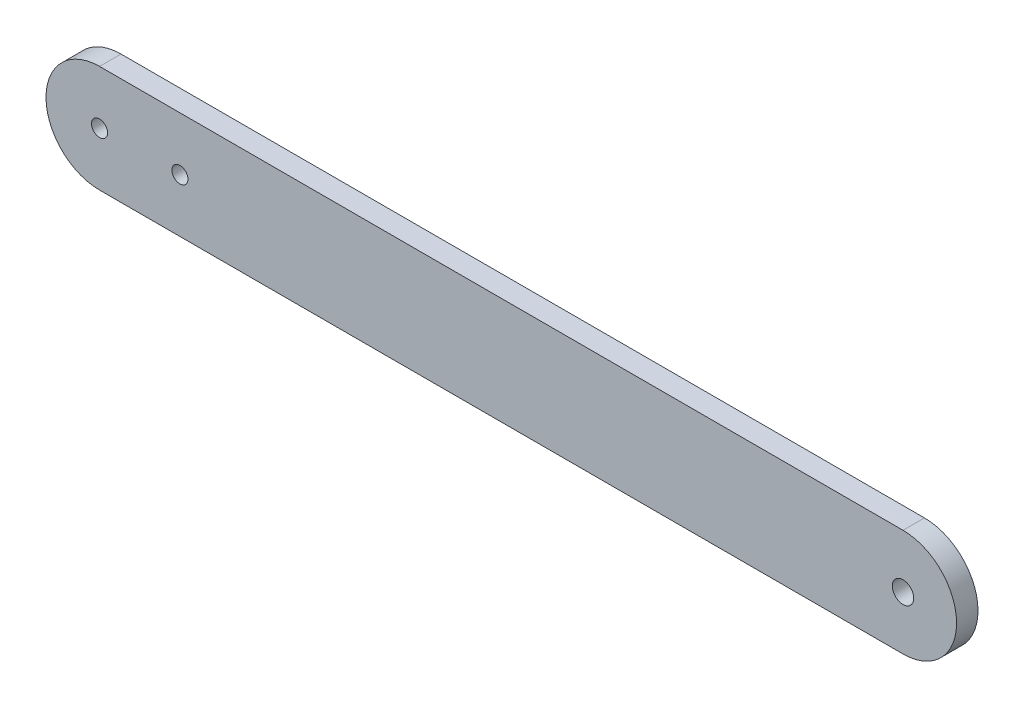
from build123d import *

# Parameters (mm, degrees)
ESQUISSE1_W        = 170
ESQUISSE1_H        = 20
ESQUISSE1_R        = 1.5
ESQUISSE1_R_2      = 2
BOSS_EXTRU_1_DEPTH = 4
CONG_1_RADIUS      = 10
CONG_1_LENGTH      = 4
CONG_2_RADIUS      = 10
CONG_2_LENGTH      = 4


with BuildPart() as part:
    # Esquisse1 → Boss.-Extru.1 (new body)
    with BuildSketch(Plane.XY):
        with Locations((-85, 10)):
            Rectangle(ESQUISSE1_W, ESQUISSE1_H)
        with Locations((-160, 10)):
            Circle(ESQUISSE1_R, mode=Mode.SUBTRACT)
        with Locations((-10, 10)):
            Circle(ESQUISSE1_R_2, mode=Mode.SUBTRACT)
        with Locations((-145, 10)):
            Circle(ESQUISSE1_R, mode=Mode.SUBTRACT)
    extrude(amount=BOSS_EXTRU_1_DEPTH)

    # Congé1: full round fillet: the end face becomes a half cylinder, R = half its width
    cong_1_face = Plane((-170, 10, 2), x_dir=(0, 0, 1), z_dir=(-1, 0, 0))  # on the end face: x along it, z out of the body
    cong_1_slab = cong_1_face.offset(-CONG_1_RADIUS / 2) * Box(CONG_1_LENGTH, 2 * CONG_1_RADIUS, CONG_1_RADIUS, mode=Mode.PRIVATE)  # the body's end, R deep
    cong_1_round = Plane((-160, 10, 2), x_dir=(-1, 0, 0), z_dir=(0, 0, 1)) * Cylinder(CONG_1_RADIUS, CONG_1_LENGTH, mode=Mode.PRIVATE)  # its axis R under the face
    add(cong_1_slab - cong_1_round, mode=Mode.SUBTRACT)

    # Congé2: full round fillet: the end face becomes a half cylinder, R = half its width
    cong_2_face = Plane((0, 10, 2), x_dir=(0, 0, -1), z_dir=(1, 0, 0))  # on the end face: x along it, z out of the body
    cong_2_slab = cong_2_face.offset(-CONG_2_RADIUS / 2) * Box(CONG_2_LENGTH, 2 * CONG_2_RADIUS, CONG_2_RADIUS, mode=Mode.PRIVATE)  # the body's end, R deep
    cong_2_round = Plane((-10, 10, 2), x_dir=(1, 0, 0), z_dir=(0, 0, -1)) * Cylinder(CONG_2_RADIUS, CONG_2_LENGTH, mode=Mode.PRIVATE)  # its axis R under the face
    add(cong_2_slab - cong_2_round, mode=Mode.SUBTRACT)


solid = part.part
